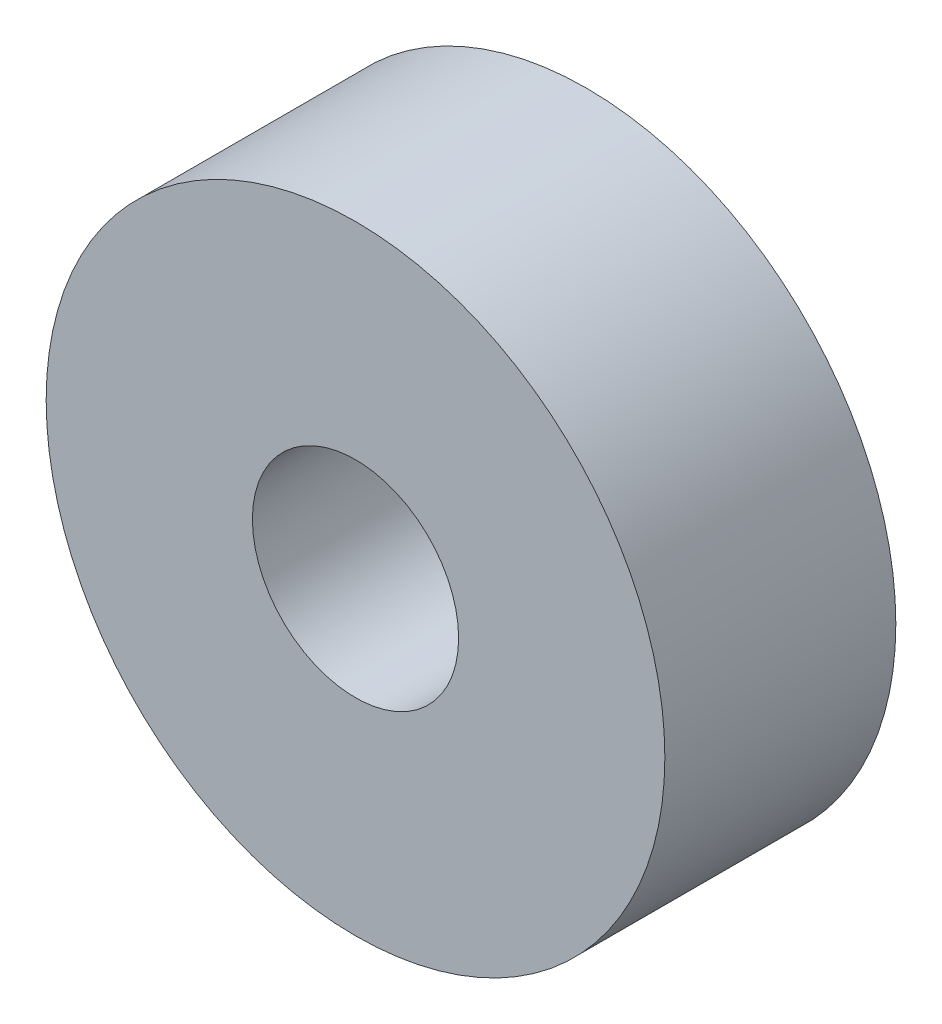
from build123d import *

# Parameters (mm, degrees)
SKETCH1_R           = 9.525
SKETCH1_R_2         = 3.175
BOSS_EXTRUDE1_DEPTH = 7.112


with BuildPart() as part:
    # Sketch1 → Boss-Extrude1 (new body)
    with BuildSketch(Plane.XY):
        Circle(SKETCH1_R)
        Circle(SKETCH1_R_2, mode=Mode.SUBTRACT)
    extrude(amount=BOSS_EXTRUDE1_DEPTH)


solid = part.part
